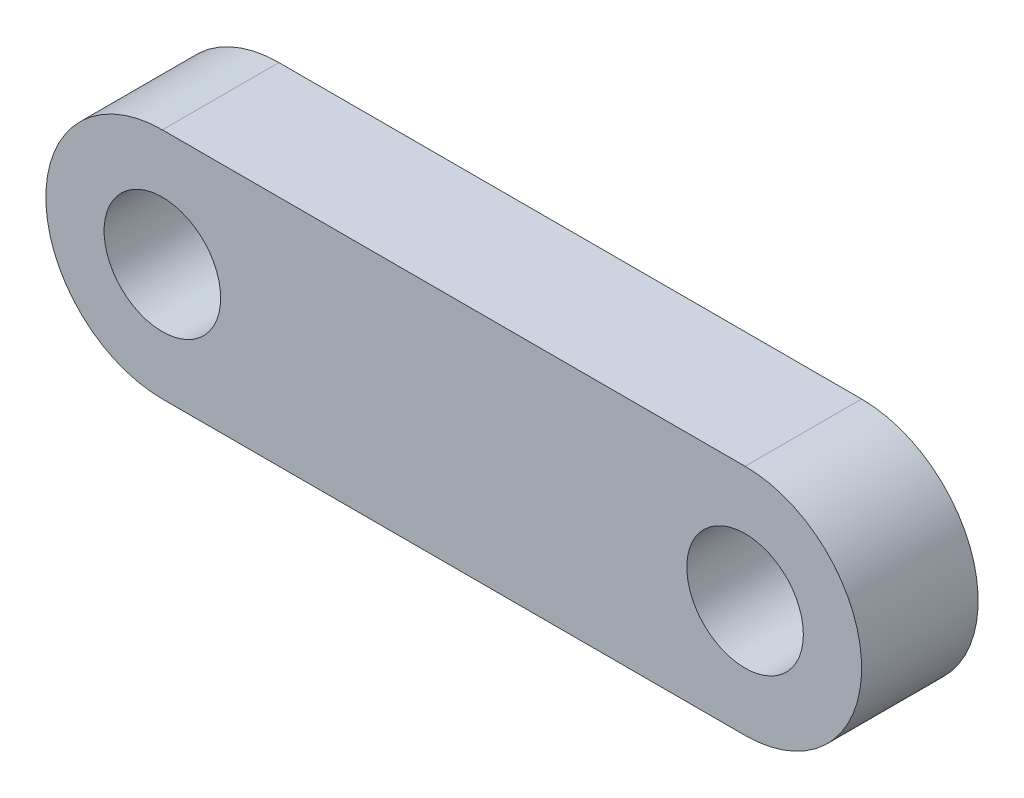
from build123d import *

# Parameters (mm, degrees)
SKETCH_1_R      = 1
EXTRUDE_1_DEPTH = 2


with BuildPart() as part:
    # 草圖1 → 填料-伸長1 (new body)
    with BuildSketch(Plane.XY):
        with BuildLine():
            Line((-4.999999993, 2.000257988), (5.000000007, 2.000257988))
            ThreePointArc((5.000000007, 2.000257988), (7.000000007, 0.000257988), (5.000000007, -1.999742012))
            Line((5.000000007, -1.999742012), (-4.999999993, -1.999742012))
            ThreePointArc((-4.999999993, -1.999742012), (-6.999999993, 0.000257988), (-4.999999993, 2.000257988))
        make_face()
        with Locations((-4.999999993, 0.000257988)):
            Circle(SKETCH_1_R, mode=Mode.SUBTRACT)
        with Locations((5.000000007, 0.000257988)):
            Circle(SKETCH_1_R, mode=Mode.SUBTRACT)
    extrude(amount=EXTRUDE_1_DEPTH)


solid = part.part
